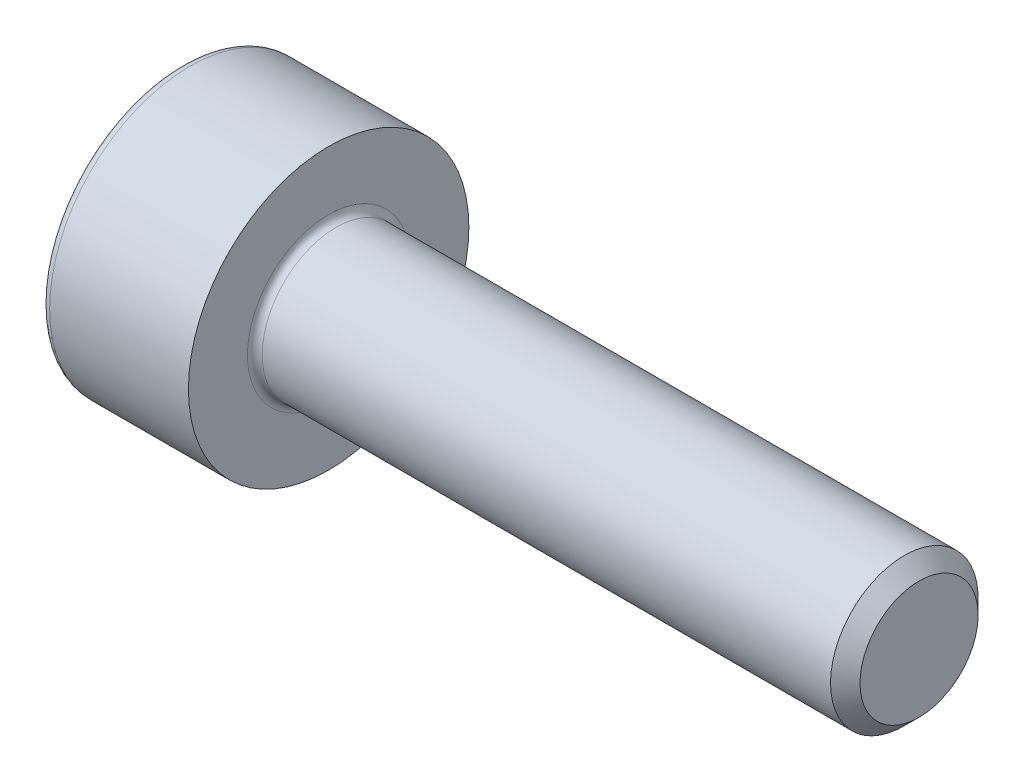
from build123d import *

# Parameters (mm, degrees)
FILLET1_R      = 0.1
FILLET2_R      = 0.12
CHAMFER1_SIZE  = 0.2
EXTRUDE1_DEPTH = 1


with BuildPart() as part:
    # Sketch1 → Revolve1 (revolve)
    with BuildSketch(Plane.XY, mode=Mode.PRIVATE) as revolve1_sk:
        Polygon((2, 1), (2, 0), (4.279914881, 0), (10, 0), (10, 1), align=None)
        Polygon((0, 1.9), (0, 0), (2, 0), (2, 1), (2, 1.9), align=None)
    revolve(revolve1_sk.sketch.rotate(Axis((0, 0, 0), (1, 0, 0)), 90), axis=Axis((0, 0, 0), (1, 0, 0)))

    # Fillet1
    fillet1_edges = [part.edges().sort_by_distance(p)[0] for p in [
        (2, 0, -1),
    ]]
    fillet(fillet1_edges, radius=FILLET1_R)

    # Fillet2
    fillet2_edges = [part.edges().sort_by_distance(p)[0] for p in [
        (0, 0, -1.9),
    ]]
    fillet(fillet2_edges, radius=FILLET2_R)

    # Chamfer1
    chamfer1_edges = [part.edges().sort_by_distance(p)[0] for p in [
        (10, 0, -1),
    ]]
    chamfer(chamfer1_edges, length=CHAMFER1_SIZE)

    # Sketch2 → Extrude1 (cut)
    with BuildSketch(Plane.ZY):
        Polygon((0, 0.866025404), (-0.75, 0.433012702), (-0.75, -0.433012702), (0, -0.866025404), (0.75, -0.433012702), (0.75, 0.433012702), align=None)
    extrude(amount=-EXTRUDE1_DEPTH, mode=Mode.SUBTRACT)


solid = part.part
